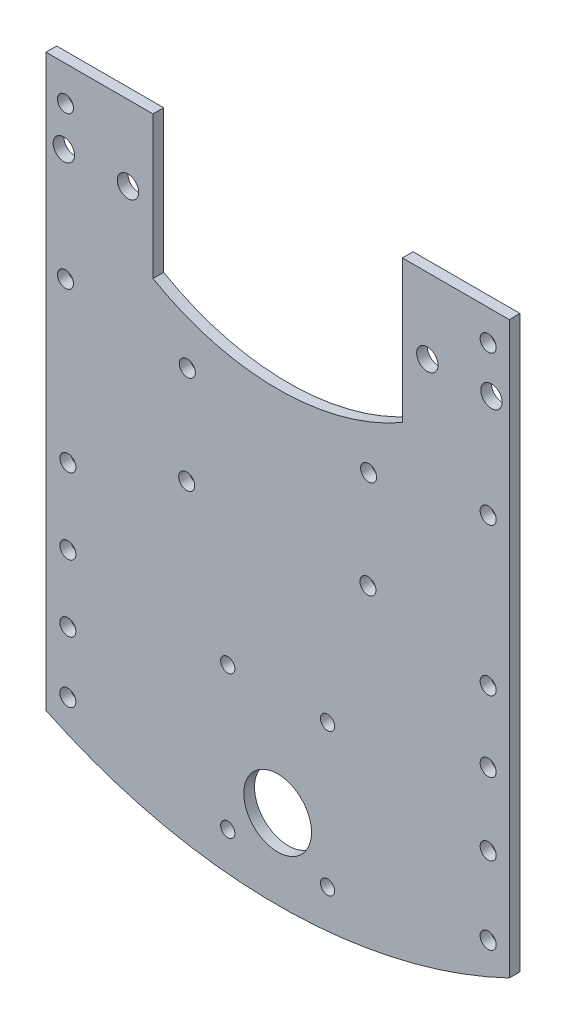
from build123d import *

# Parameters (mm, degrees)
SKETCH1_R           = 3
BOSS_EXTRUDE2_DEPTH = 3
SKETCH4_R           = 9.5
CUT_EXTRUDE2_DEPTH  = 10
SKETCH5_R           = 2
CUT_EXTRUDE3_DEPTH  = 3
SKETCH6_R           = 2.25
CUT_EXTRUDE4_DEPTH  = 3
SKETCH7_R           = 2.25
CUT_EXTRUDE5_DEPTH  = 10


with BuildPart() as part:
    # Sketch1 → Boss-Extrude2 (new body)
    with BuildSketch(Plane.XY):
        with BuildLine():
            Line((-34.17966517, 1.656542757), (-34.17966517, 41.656542757))
            Line((-34.17966517, 41.656542757), (-64.17966517, 41.656542757))
            Line((-64.17966517, 41.656542757), (-64.17966517, -118.343457243))
            ThreePointArc((-64.17966517, -118.343457243), (0.82033483, -133.158398897), (65.82033483, -118.343457243))
            Line((65.82033483, -118.343457243), (65.82033483, 41.656542757))
            Line((65.82033483, 41.656542757), (35.82033483, 41.656542757))
            Line((35.82033483, 41.656542757), (35.82033483, 1.656542757))
            ThreePointArc((35.82033483, 1.656542757), (0.82033483, -7.721678978), (-34.17966517, 1.656542757))
        make_face()
        with Locations((60.82033483, 20.554474708)):
            Circle(SKETCH1_R, mode=Mode.SUBTRACT)
        with Locations((42.82033483, 20.554474708)):
            Circle(SKETCH1_R, mode=Mode.SUBTRACT)
        with Locations(Location((-59.17966517, 20.554474708, 0), (0, 0, 180))):
            Circle(SKETCH1_R, mode=Mode.SUBTRACT)
        with Locations(Location((-41.17966517, 20.554474708, 0), (0, 0, 180))):
            Circle(SKETCH1_R, mode=Mode.SUBTRACT)
    extrude(amount=BOSS_EXTRUDE2_DEPTH)

    # Sketch4 → Cut-Extrude2 (cut)
    with BuildSketch(Plane.XY.offset(3)):
        with Locations((0.82033483, -110.721678978)):
            Circle(SKETCH4_R)
    extrude(amount=-CUT_EXTRUDE2_DEPTH, mode=Mode.SUBTRACT)

    # Sketch5 → Cut-Extrude3 (cut)
    with BuildSketch(Plane(origin=(0, 0, 0), x_dir=(-1, 0, 0), z_dir=(0, 0, -1))):
        with Locations((-14.82033483, -121.721678978)):
            Circle(SKETCH5_R)
        with Locations((-14.82033483, -81.721678978)):
            Circle(SKETCH5_R)
        with Locations((13.17966517, -81.721678978)):
            Circle(SKETCH5_R)
        with Locations((13.17966517, -121.721678978)):
            Circle(SKETCH5_R)
    extrude(amount=-CUT_EXTRUDE3_DEPTH, mode=Mode.SUBTRACT)

    # Sketch6 → Cut-Extrude4 (cut)
    with BuildSketch(Plane(origin=(0, 0, 0), x_dir=(-1, 0, 0), z_dir=(0, 0, -1))):
        with Locations((-26.170124502, -42.870278614)):
            Circle(SKETCH6_R)
        with Locations((-26.339734066, -15.290278614)):
            Circle(SKETCH6_R)
        with Locations((24.529454842, -15.290278614)):
            Circle(SKETCH6_R)
        with Locations((24.699064406, -42.870278614)):
            Circle(SKETCH6_R)
    extrude(amount=-CUT_EXTRUDE4_DEPTH, mode=Mode.SUBTRACT)

    # Sketch7 → Cut-Extrude5 (cut)
    with BuildSketch(Plane.XY.offset(3)):
        with Locations((-58.050753667, -112.076170868)):
            Circle(SKETCH7_R)
        with Locations((-58.050753667, -94.961890213)):
            Circle(SKETCH7_R)
        with Locations((-58.050753667, -76.250276697)):
            Circle(SKETCH7_R)
        with Locations((-58.050753667, -55.028568685)):
            Circle(SKETCH7_R)
        with Locations((-58.735324893, -10.759629391)):
            Circle(SKETCH7_R)
        with Locations((-58.735324893, 31.901332055)):
            Circle(SKETCH7_R)
        with Locations((59.892687825, -112.115366711)):
            Circle(SKETCH7_R)
        with Locations((59.892687825, -90.405584769)):
            Circle(SKETCH7_R)
        with Locations((59.892687825, -70.121992882)):
            Circle(SKETCH7_R)
        with Locations((59.892687825, -50.255835401)):
            Circle(SKETCH7_R)
        with Locations((59.892687825, -8.825910752)):
            Circle(SKETCH7_R)
        with Locations((59.892687825, 33.03311017)):
            Circle(SKETCH7_R)
    extrude(amount=-CUT_EXTRUDE5_DEPTH, mode=Mode.SUBTRACT)


solid = part.part
